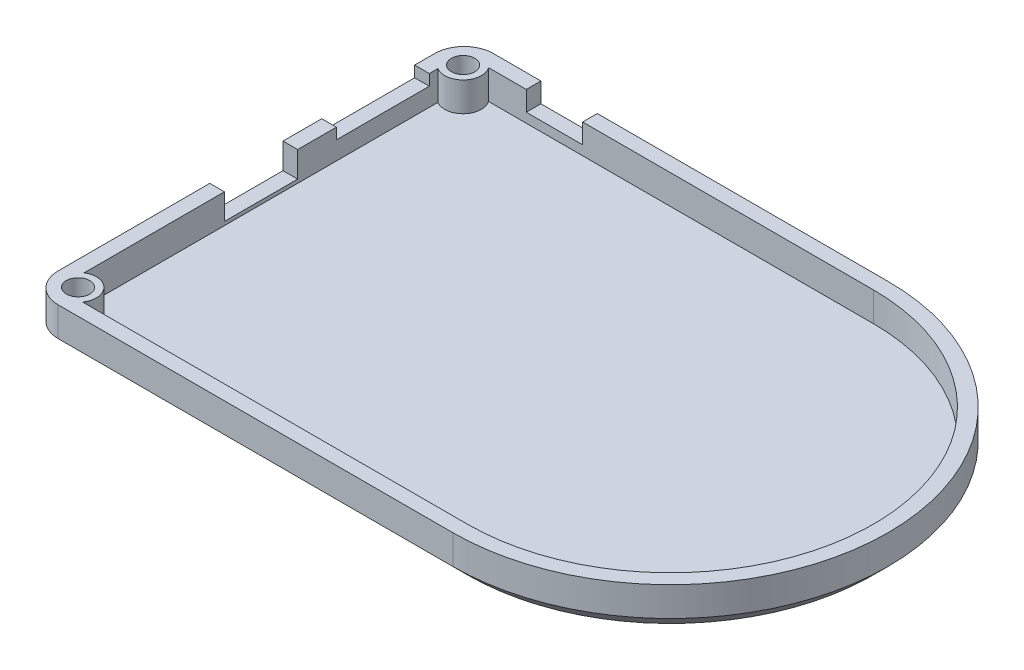
from build123d import *

# Parameters (mm, degrees)
EXTRUDE_1_DEPTH     = 2
EXTRUDE_2_DEPTH     = 4
SKETCH_3_R          = 1.6
SKETCH_3_W          = 7.7
SKETCH_3_H          = 2
SKETCH_3_W_2        = 4
SKETCH_3_H_2        = 10
CUT_EXTRUDE_1_DEPTH = 2.7
SKETCH_4_R          = 1.6
CUT_EXTRUDE_2_DEPTH = 5
CHAMFER_1_SIZE      = 2
SKETCH_5_W          = 2
SKETCH_5_H          = 12.69
CUT_EXTRUDE_3_DEPTH = 1.5
SKETCH_6_W          = 2
SKETCH_6_H          = 10
CUT_EXTRUDE_4_DEPTH = 0.8


with BuildPart() as part:
    # 草图1 → 凸台-拉伸1 (new body)
    with BuildSketch(Plane(origin=(0, 0, 0), x_dir=(1, 0, 0), z_dir=(0, 1, 0))):
        with BuildLine():
            Line((-24.955, -29.72), (28.955, -29.72))
            ThreePointArc((28.955, -29.72), (58.675, 0), (28.955, 29.72))
            Line((28.955, 29.72), (-24.955, 29.72))
            ThreePointArc((-24.955, 29.72), (-27.783427125, 28.548427125), (-28.955, 25.72))
            Line((-28.955, 25.72), (-28.955, -25.72))
            ThreePointArc((-28.955, -25.72), (-27.783427125, -28.548427125), (-24.955, -29.72))
        make_face()
    extrude(amount=EXTRUDE_1_DEPTH)

    # 草图2 → 凸台-拉伸2 (add)
    with BuildSketch(Plane(origin=(0, 2, 0), x_dir=(1, 0, 0), z_dir=(0, 1, 0))):
        with BuildLine():
            Line((28.955, 29.72), (-24.955, 29.72))
            ThreePointArc((-24.955, 29.72), (-27.783427125, 28.548427125), (-28.955, 25.72))
            Line((-28.955, 25.72), (-28.955, -25.72))
            ThreePointArc((-28.955, -25.72), (-27.783427125, -28.548427125), (-24.955, -29.72))
            Line((-24.955, -29.72), (28.955, -29.72))
            ThreePointArc((28.955, -29.72), (58.675, 0), (28.955, 29.72))
        make_face()
        with BuildLine():
            Line((-26.955, 24.15458435), (-26.955, -24.15458435))
            ThreePointArc((-26.955, -24.15458435), (-23.8332124, -24.577957377), (-23.604365952, -27.72))
            Line((-23.604365952, -27.72), (28.955, -27.72))
            ThreePointArc((28.955, -27.72), (56.675, 0), (28.955, 27.72))
            Line((28.955, 27.72), (-23.604365952, 27.72))
            ThreePointArc((-23.604365952, 27.72), (-23.8332124, 24.577957377), (-26.955, 24.15458435))
        make_face(mode=Mode.SUBTRACT)
    extrude(amount=EXTRUDE_2_DEPTH)

    # 草图3 → 切除-拉伸1 (cut)
    with BuildSketch(Plane(origin=(0, 6, 0), x_dir=(1, 0, 0), z_dir=(0, 1, 0))):
        with Locations(Location((-25.655, 26.29, 0), (0, 0, 270))):
            Circle(SKETCH_3_R)
        with Locations(Location((-25.655, -26.29, 0), (0, 0, 270))):
            Circle(SKETCH_3_R)
        with Locations((-14.605, 28.72)):
            Rectangle(SKETCH_3_W, SKETCH_3_H)
        with Locations((-28.955, 0)):
            Rectangle(SKETCH_3_W_2, SKETCH_3_H_2)
    extrude(amount=-CUT_EXTRUDE_1_DEPTH, mode=Mode.SUBTRACT)

    # 草图4 → 切除-拉伸2 (cut)
    with BuildSketch(Plane(origin=(0, 6, 0), x_dir=(1, 0, 0), z_dir=(0, 1, 0))):
        with Locations(Location((-25.655, 26.29, 0), (0, 0, 270))):
            Circle(SKETCH_4_R)
        with Locations(Location((-25.655, -26.29, 0), (0, 0, 270))):
            Circle(SKETCH_4_R)
    extrude(amount=-CUT_EXTRUDE_2_DEPTH, mode=Mode.SUBTRACT)

    # 倒角1
    chamfer_1_edges = [part.edges().sort_by_distance(p)[0] for p in [
        (2, 0, 29.72),
        (-27.783427125, 0, 28.548427125),
        (-28.955, 0, 0),
        (-27.783427125, 0, -28.548427125),
        (2, 0, -29.72),
        (58.675, 0, 0),
    ]]
    chamfer(chamfer_1_edges, length=CHAMFER_1_SIZE)

    # 草图5 → 切除-拉伸3 (cut)
    with BuildSketch(Plane(origin=(0, 6, 0), x_dir=(1, 0, 0), z_dir=(0, 1, 0))):
        with Locations((-27.955, 16.635)):
            Rectangle(SKETCH_5_W, SKETCH_5_H)
    extrude(amount=-CUT_EXTRUDE_3_DEPTH, mode=Mode.SUBTRACT)

    # 草图6 → 切除-拉伸4 (cut)
    with BuildSketch(Plane(origin=(0, 3.3, 0), x_dir=(1, 0, 0), z_dir=(0, 1, 0))):
        with Locations((-27.955, 0)):
            Rectangle(SKETCH_6_W, SKETCH_6_H)
    extrude(amount=-CUT_EXTRUDE_4_DEPTH, mode=Mode.SUBTRACT)


solid = part.part
